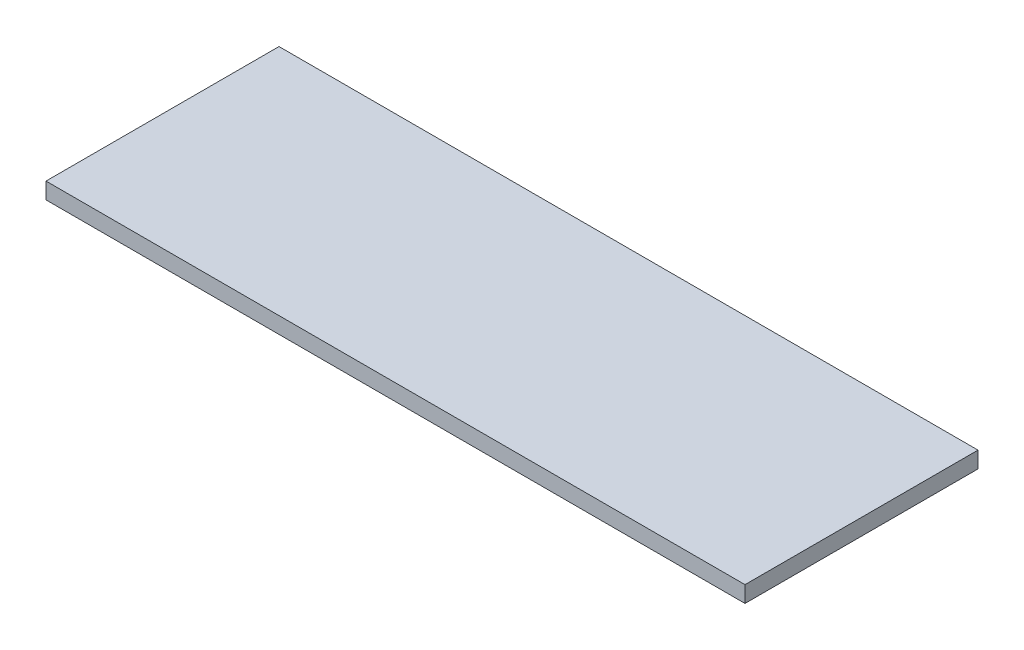
from build123d import *

# Parameters (mm, degrees)
SKETCH1_W           = 30
SKETCH1_H           = 10
BOSS_EXTRUDE1_DEPTH = 0.7


with BuildPart() as part:
    # Sketch1 → Boss-Extrude1 (new body)
    with BuildSketch(Plane(origin=(0, 0, 0), x_dir=(1, 0, 0), z_dir=(0, 1, 0))):
        Rectangle(SKETCH1_W, SKETCH1_H)
    extrude(amount=BOSS_EXTRUDE1_DEPTH)


solid = part.part
